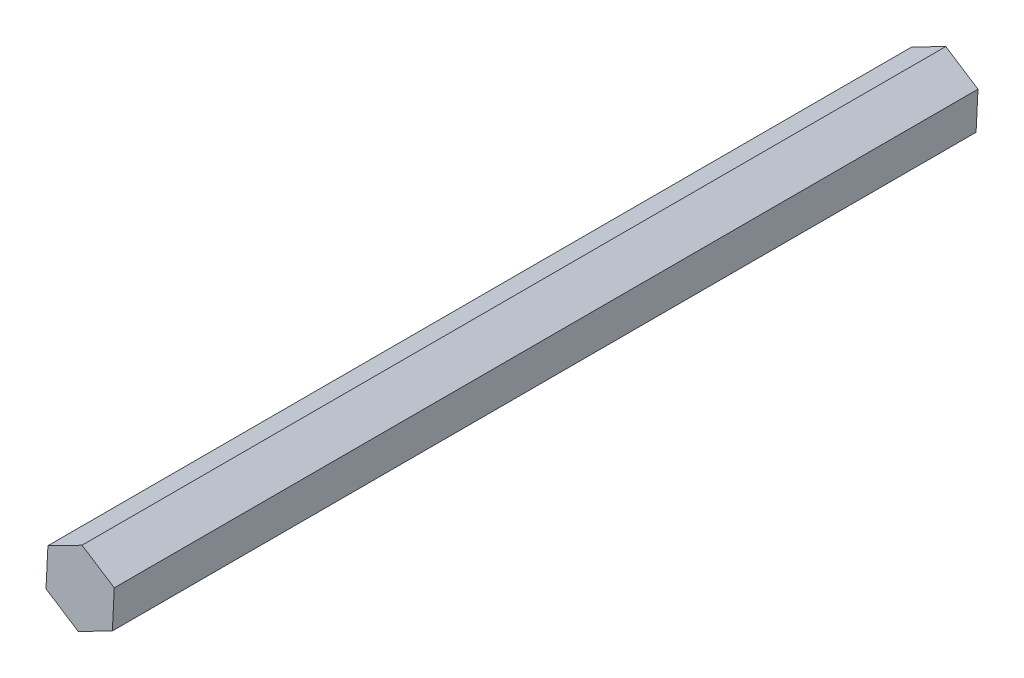
from build123d import *

# Parameters (mm, degrees)
BOSS_EXTRUDE1_DEPTH = 165.1


with BuildPart() as part:
    # Sketch1 → Boss-Extrude1 (new body)
    with BuildSketch(Plane.XY):
        Polygon((-6.158943856, 3.978786739), (-6.52520232, -3.34440847), (-0.366258464, -7.323195209), (6.158943856, -3.978786739), (6.52520232, 3.34440847), (0.366258464, 7.323195209), align=None)
    extrude(amount=BOSS_EXTRUDE1_DEPTH)


solid = part.part
